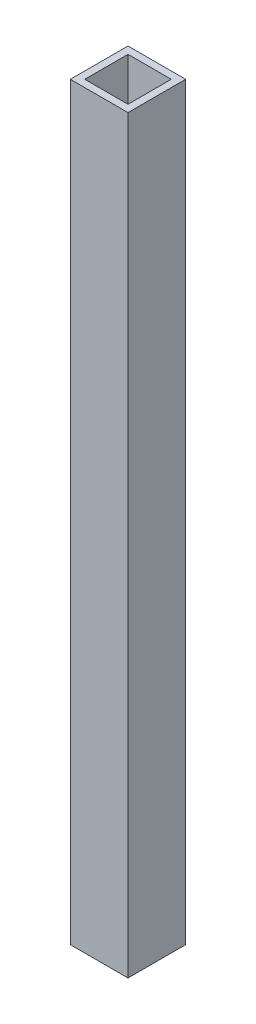
from build123d import *

# Parameters (mm, degrees)
SKETCH1_W           = 25.4
SKETCH1_H           = 25.4
SKETCH1_W_2         = 19.05
SKETCH1_H_2         = 19.05
BOSS_EXTRUDE1_DEPTH = 330.2


with BuildPart() as part:
    # Sketch1 → Boss-Extrude1 (new body)
    with BuildSketch(Plane(origin=(0, 0, 0), x_dir=(1, 0, 0), z_dir=(0, 1, 0))):
        Rectangle(SKETCH1_W, SKETCH1_H)
        Rectangle(SKETCH1_W_2, SKETCH1_H_2, mode=Mode.SUBTRACT)
    extrude(amount=BOSS_EXTRUDE1_DEPTH)


solid = part.part
